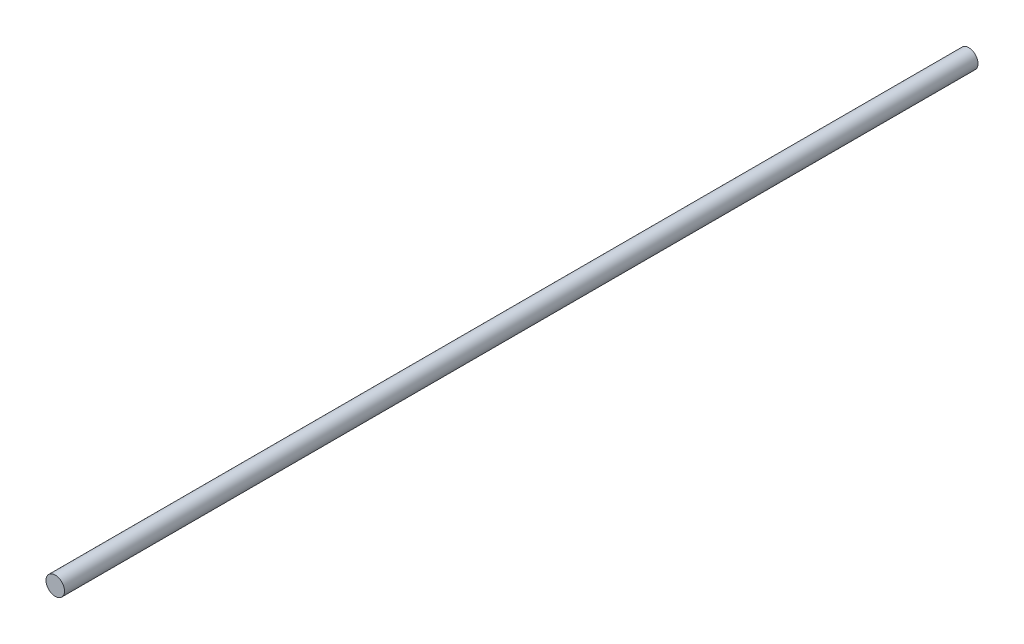
from build123d import *

# Parameters (mm, degrees)
SKETCH1_R           = 4
BOSS_EXTRUDE1_DEPTH = 395


with BuildPart() as part:
    # Sketch1 → Boss-Extrude1 (new body)
    with BuildSketch(Plane.XY):
        with Locations(Location((0, 0, 0), (0, 0, 180))):
            Circle(SKETCH1_R)
    extrude(amount=BOSS_EXTRUDE1_DEPTH)


solid = part.part
